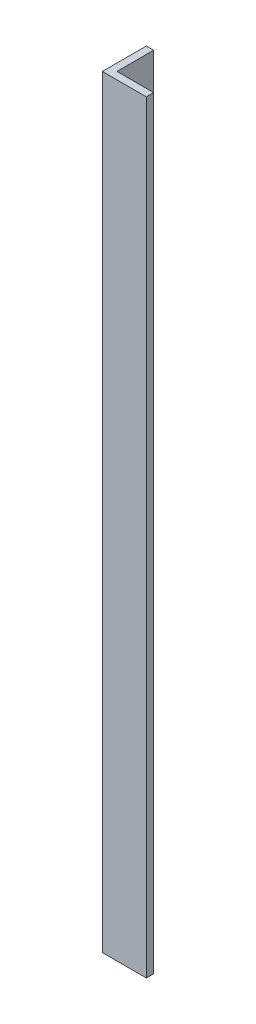
from build123d import *

# Parameters (mm, degrees)
BOSS_EXTRUDE1_DEPTH = 330.2
CUT_EXTRUDE1_REACH  = 333.13
SKETCH2_R           = 2.413


with BuildPart() as part:
    # Sketch1 → Boss-Extrude1 (new body)
    with BuildSketch(Plane(origin=(0, 0, 0), x_dir=(1, 0, 0), z_dir=(0, 1, 0))):
        Polygon((3.175, 3.175), (3.175, 19.05), (0, 19.05), (0, 0), (19.05, 0), (19.05, 3.175), align=None)
    extrude(amount=BOSS_EXTRUDE1_DEPTH)

    # Sketch2 → Cut-Extrude1 (cut, up to next)
    with BuildSketch(Plane(origin=(3.175, 0, 0), x_dir=(0, 0, -1), z_dir=(1, 0, 0)), mode=Mode.PRIVATE) as cut_extrude1_sk1:
        with Locations((12.7, 53.975)):
            Circle(SKETCH2_R)
    cut_extrude1_tool1 = extrude(cut_extrude1_sk1.sketch, amount=-CUT_EXTRUDE1_REACH, mode=Mode.PRIVATE) & part.part
    # Sketch2 → Cut-Extrude1 (cut, up to next)
    with BuildSketch(Plane(origin=(3.175, 0, 0), x_dir=(0, 0, -1), z_dir=(1, 0, 0)), mode=Mode.PRIVATE) as cut_extrude1_sk2:
        with Locations((12.7, 301.625)):
            Circle(SKETCH2_R)
    cut_extrude1_tool2 = extrude(cut_extrude1_sk2.sketch, amount=-CUT_EXTRUDE1_REACH, mode=Mode.PRIVATE) & part.part
    add(cut_extrude1_tool1.solids().sort_by_distance((3.175, 53.975, -12.7))[0], mode=Mode.SUBTRACT)
    add(cut_extrude1_tool2.solids().sort_by_distance((3.175, 301.625, -12.7))[0], mode=Mode.SUBTRACT)


solid = part.part
